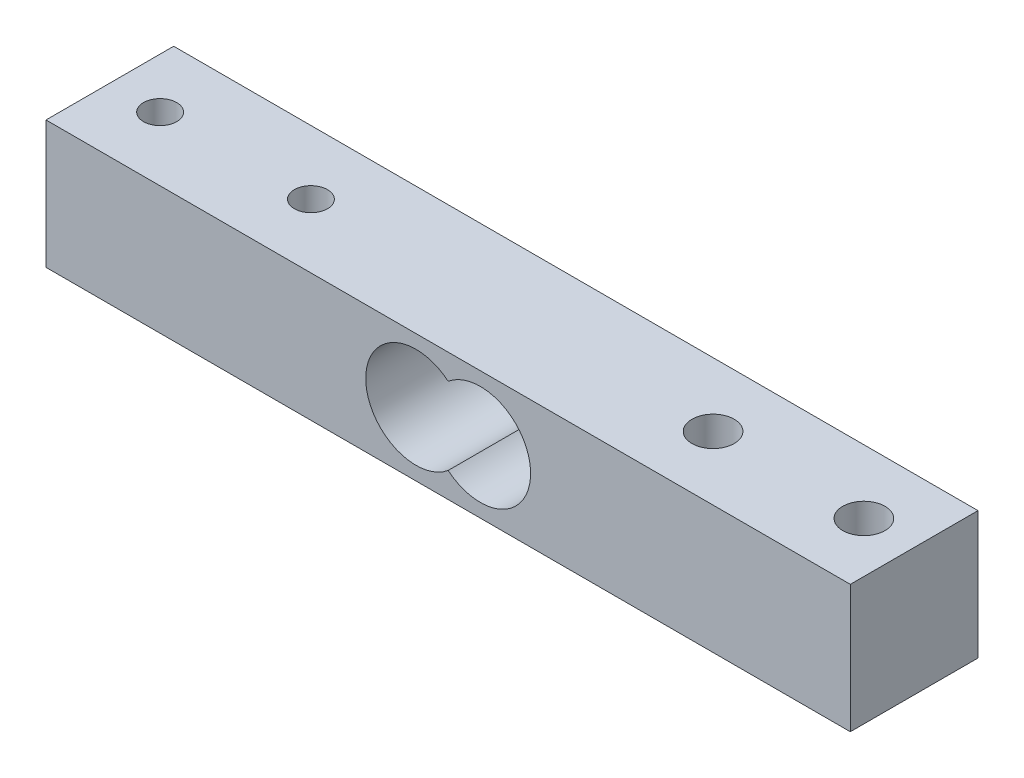
from build123d import *

# Parameters (mm, degrees)
CROQUIS1_W                                 = 80
CROQUIS1_H                                 = 12.7
SALIENTE_EXTRUIR1_DEPTH                    = 12.7
PERFORADOR_PARA_ROSCAR_PARA_MACHO_DE_ROS_D = 3.3
PERFORADOR_PARA_ROSCAR_PARA_MACHO_DE_2_D   = 4.2


with BuildPart() as part:
    # Croquis1 → Saliente-Extruir1 (new body)
    with BuildSketch(Plane.XY):
        Rectangle(CROQUIS1_W, CROQUIS1_H)
        with BuildLine():
            ThreePointArc((0, 3.841213022), (-8.200794046, 0), (0, -3.841213022))
            ThreePointArc((0, -3.841213022), (8.200794046, 0), (0, 3.841213022))
        make_face(mode=Mode.SUBTRACT)
    extrude(amount=SALIENTE_EXTRUIR1_DEPTH)

    # Perforador para roscar para macho de ros (through all)
    with Locations(Plane(origin=(0, 6.35, 0), x_dir=(1, 0, 0), z_dir=(0, 1, 0))):
        with Locations((-35, -6.35), (-20, -6.35)):
            Hole(PERFORADOR_PARA_ROSCAR_PARA_MACHO_DE_ROS_D / 2)

    # Perforador para roscar para macho de 2 (through all)
    with Locations(Plane(origin=(0, 6.35, 0), x_dir=(1, 0, 0), z_dir=(0, 1, 0))):
        with Locations((35, -6.35), (20, -6.35)):
            Hole(PERFORADOR_PARA_ROSCAR_PARA_MACHO_DE_2_D / 2)


solid = part.part
